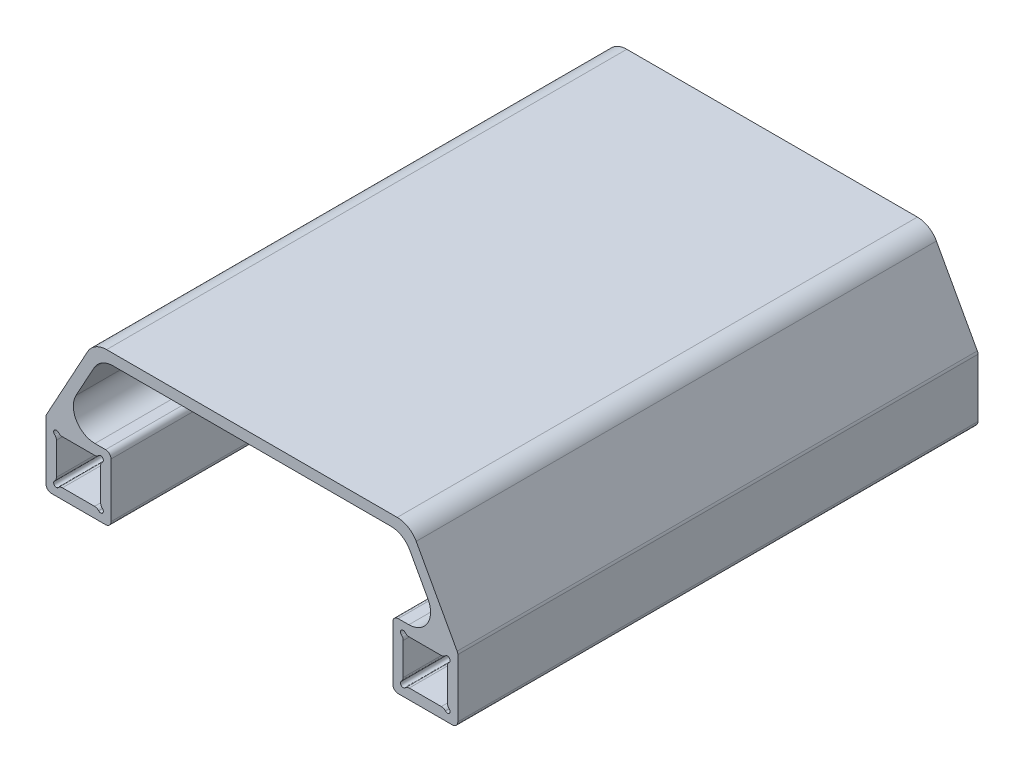
from build123d import *

# Parameters (mm, degrees)
SKETCH1_W           = 6.477
SKETCH1_H           = 6.477
BOSS_EXTRUDE1_DEPTH = 76.2
FILLET1_R           = 3.175
FILLET2_R           = 0.79375
SKETCH2_R           = 0.396875
CUT_EXTRUDE1_DEPTH  = 95.254215992
FILLET3_R           = 0.79375


with BuildPart() as part:
    # Sketch1 → Boss-Extrude1 (new body)
    with BuildSketch(Plane.XY):
        Polygon((-9.525, 0), (0, 0), (0, 9.525), (-7.714580181, 9.525), (-1.5875, 20.701), (42.8625, 20.701), (48.989580181, 9.525), (41.275, 9.525), (41.275, 0), (50.8, 0), (50.8, 9.525), (43.80259593, 22.2885), (-2.52759593, 22.2885), (-9.525, 9.525), align=None)
        with Locations((-4.7625, 4.7625)):
            Rectangle(SKETCH1_W, SKETCH1_H, mode=Mode.SUBTRACT)
        with Locations((46.0375, 4.7625)):
            Rectangle(SKETCH1_W, SKETCH1_H, mode=Mode.SUBTRACT)
    extrude(amount=BOSS_EXTRUDE1_DEPTH)

    # Fillet1
    fillet1_edges = [part.edges().sort_by_distance(p)[0] for p in [
        (-2.52759593, 22.2885, 38.1),
        (43.80259593, 22.2885, 38.1),
        (48.989580181, 9.525, 38.1),
        (42.8625, 20.701, 38.1),
        (-1.5875, 20.701, 38.1),
        (-7.714580181, 9.525, 38.1),
    ]]
    fillet(fillet1_edges, radius=FILLET1_R)

    # Fillet2
    fillet2_edges = [part.edges().sort_by_distance(p)[0] for p in [
        (0, 0, 38.1),
        (-9.525, 0, 38.1),
        (-9.525, 9.525, 38.1),
        (50.8, 9.525, 38.1),
        (50.8, 0, 38.1),
        (41.275, 0, 38.1),
        (41.275, 9.525, 38.1),
        (0, 9.525, 38.1),
    ]]
    fillet(fillet2_edges, radius=FILLET2_R)

    # Sketch2 → Cut-Extrude1 (cut, through all)
    with BuildSketch(Plane.XY.offset(76.2)):
        with Locations((-8.001, 8.001)):
            Circle(SKETCH2_R)
        with Locations((-1.524, 8.001)):
            Circle(SKETCH2_R)
        with Locations((-1.524, 1.524)):
            Circle(SKETCH2_R)
        with Locations((-8.001, 1.524)):
            Circle(SKETCH2_R)
        with Locations((42.799, 8.001)):
            Circle(SKETCH2_R)
        with Locations((42.799, 1.524)):
            Circle(SKETCH2_R)
        with Locations((49.276, 1.524)):
            Circle(SKETCH2_R)
        with Locations((49.276, 8.001)):
            Circle(SKETCH2_R)
    extrude(amount=-CUT_EXTRUDE1_DEPTH, mode=Mode.SUBTRACT)

    # Fillet3
    fillet3_edges = [part.edges().sort_by_distance(p)[0] for p in [
        (48.879125, 8.001, 38.1),
        (43.195875, 8.001, 38.1),
        (49.276, 1.920875, 38.1),
        (43.195875, 1.524, 38.1),
        (-1.920875, 1.524, 38.1),
        (-7.604125, 1.524, 38.1),
        (-8.001, 7.604125, 38.1),
        (-1.920875, 8.001, 38.1),
        (42.799, 7.604125, 38.1),
        (-8.001, 1.920875, 38.1),
        (-1.524, 1.920875, 38.1),
        (-1.524, 7.604125, 38.1),
        (42.799, 1.920875, 38.1),
        (48.879125, 1.524, 38.1),
        (49.276, 7.604125, 38.1),
        (-7.604125, 8.001, 38.1),
    ]]
    fillet(fillet3_edges, radius=FILLET3_R)


solid = part.part
